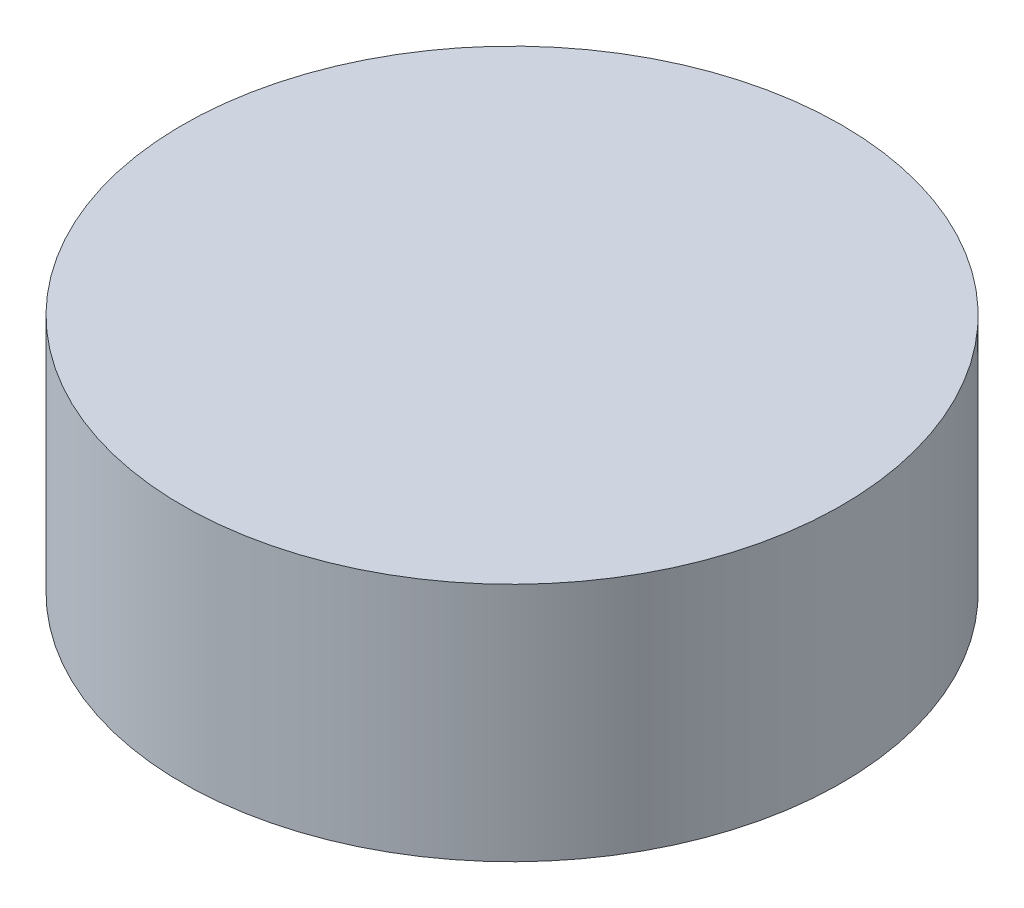
from build123d import *


with BuildPart() as part:
    # Эскиз2 → Revolve 465 (revolve)
    with BuildSketch(Plane.XY, mode=Mode.PRIVATE) as revolve_465_sk:
        with BuildLine():
            Line((0, 0), (-48, 0))
            Line((-48, 0), (-48, -35))
            Line((-48, -35), (-46, -35))
            Line((-46, -35), (-46, -5.5))
            ThreePointArc((-46, -5.5), (-45.121320344, -3.378679656), (-43, -2.5))
            Line((-43, -2.5), (0, -2.5))
            Line((0, -2.5), (0, 0))
        make_face()
    revolve(revolve_465_sk.sketch.rotate(Axis((0, 0, 0), (0, 1, 0)), 270), axis=Axis((0, 0, 0), (0, 1, 0)))


solid = part.part
